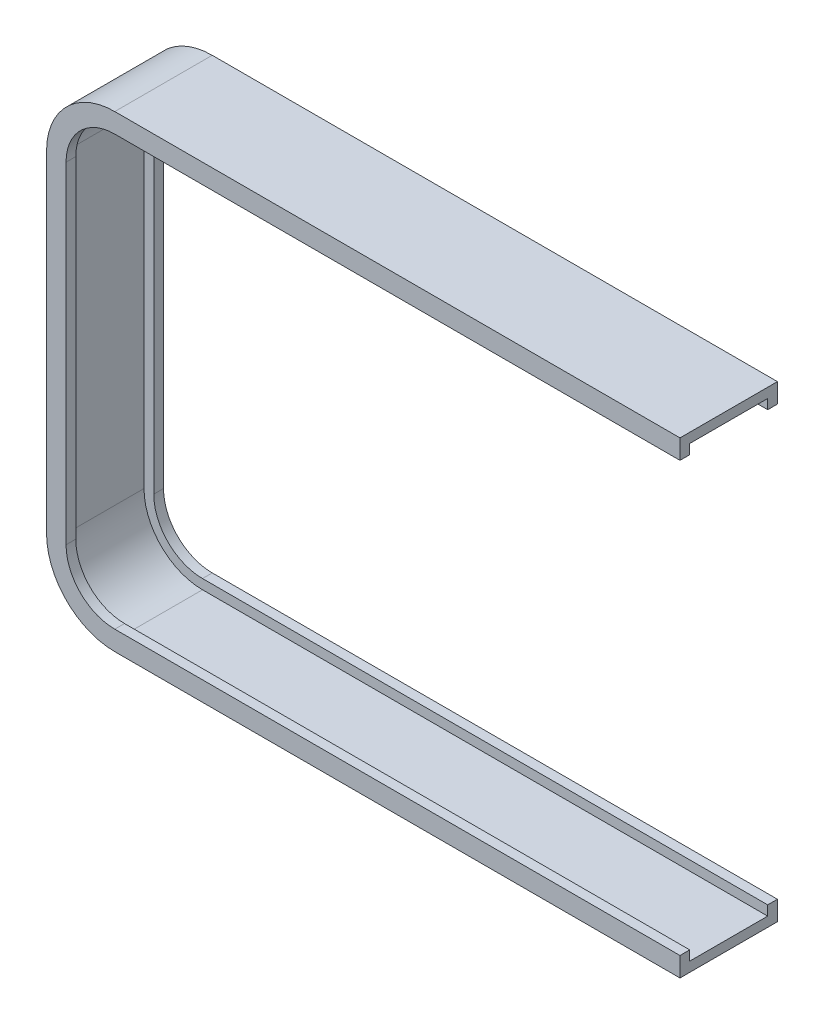
from build123d import *

# Parameters (mm, degrees)
SALIENTE_EXTRUIR1_DEPTH = 40
SALIENTE_EXTRUIR2_DEPTH = 5
SALIENTE_EXTRUIR3_DEPTH = 290


with BuildPart() as part:
    # Croquis1 → Saliente-Extruir1 (new body)
    with BuildSketch(Plane.XY):
        with BuildLine():
            Line((-2.5, -85), (-2.5, 85))
            ThreePointArc((-2.5, 85), (7.751262658, 109.748737342), (32.5, 120))
            Line((32.5, 120), (32.5, 115))
            ThreePointArc((32.5, 115), (11.286796564, 106.213203436), (2.5, 85))
            Line((2.5, 85), (2.5, -85))
            ThreePointArc((2.5, -85), (11.286796564, -106.213203436), (32.5, -115))
            Line((32.5, -115), (32.5, -120))
            ThreePointArc((32.5, -120), (7.751262658, -109.748737342), (-2.5, -85))
        make_face()
    extrude(amount=SALIENTE_EXTRUIR1_DEPTH)

    # Croquis2 → Saliente-Extruir2 (add)
    with BuildSketch(Plane.XY.offset(40)):
        with BuildLine():
            Line((-2.5, 85), (-2.5, -85))
            ThreePointArc((-2.5, -85), (7.751262658, -109.748737342), (32.5, -120))
            Line((32.5, -120), (32.5, -110))
            ThreePointArc((32.5, -110), (14.82233047, -102.67766953), (7.5, -85))
            Line((7.5, -85), (7.5, 85))
            ThreePointArc((7.5, 85), (14.82233047, 102.67766953), (32.5, 110))
            Line((32.5, 110), (32.5, 120))
            ThreePointArc((32.5, 120), (7.751262658, 109.748737342), (-2.5, 85))
        make_face()
    saliente_extruir2 = extrude(amount=SALIENTE_EXTRUIR2_DEPTH)

    # Simetría1: Saliente-Extruir2 across plane
    add(saliente_extruir2.mirror(Plane.XY.offset(20)))

    # Croquis3 → Saliente-Extruir3 (add)
    with BuildSketch(Plane(origin=(32.5, 0, 0), x_dir=(0, 0, -1), z_dir=(1, 0, 0))):
        Polygon((-45, 120), (-45, 110), (-40, 110), (-40, 115), (0, 115), (0, 110), (5, 110), (5, 120), align=None)
        Polygon((-45, -110), (-40, -110), (-40, -115), (0, -115), (0, -110), (5, -110), (5, -120), (-45, -120), align=None)
    extrude(amount=SALIENTE_EXTRUIR3_DEPTH)


solid = part.part
